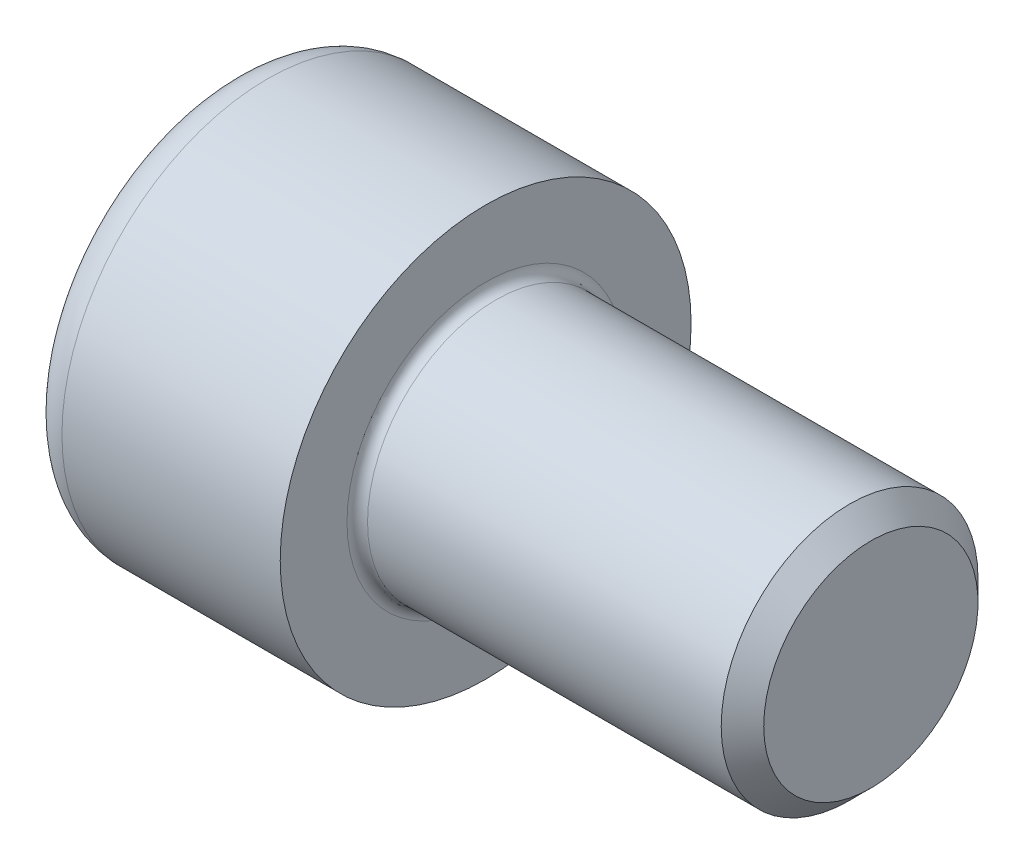
from build123d import *

# Parameters (mm, degrees)
FILLET1_R   = 0.4
FILLET2_R   = 1.5
HEX_2_DEPTH = 5


with BuildPart() as part:
    # BodySke → Base-Revolve (revolve)
    with BuildSketch(Plane.XY, mode=Mode.PRIVATE) as base_revolve_sk:
        Polygon((0, 0), (0, 8), (10, 8), (10, 5), (24.172, 5), (25, 4.172), (25, 0), align=None)
    revolve(base_revolve_sk.sketch.rotate(Axis((-31.75, 0, 0), (1, 0, 0)), 90), axis=Axis((-31.75, 0, 0), (1, 0, 0)))

    # Fillet1
    fillet1_edges = [part.edges().sort_by_distance(p)[0] for p in [
        (10, 0, -5),
    ]]
    fillet(fillet1_edges, radius=FILLET1_R)

    # Fillet2
    fillet2_edges = [part.edges().sort_by_distance(p)[0] for p in [
        (0, 0, -8),
    ]]
    fillet(fillet2_edges, radius=FILLET2_R)

    # Sketch2 → Hex-PreBroach (revolve, cut)
    with BuildSketch(Plane.XY, mode=Mode.PRIVATE) as hex_prebroach_sk:
        Polygon((0, 4.0575), (5, 4.0575), (7.342598717, 0), (0, 0), align=None)
    revolve(hex_prebroach_sk.sketch.rotate(Axis((0, 0, 0), (1, 0, 0)), 90), axis=Axis((0, 0, 0), (1, 0, 0)), mode=Mode.SUBTRACT)

    # Sketch3 → Hex 2 (cut)
    with BuildSketch(Plane(origin=(0, 0, 0), x_dir=(0, 0.500000000000001, 0.866025403784438), z_dir=(-1, 0, 0))):
        Polygon((2.342598717, 4.0575), (-2.342598717, 4.0575), (-4.685197434, 0), (-2.342598717, -4.0575), (2.342598717, -4.0575), (4.685197434, 0), align=None)
    extrude(amount=-HEX_2_DEPTH, mode=Mode.SUBTRACT)


solid = part.part
